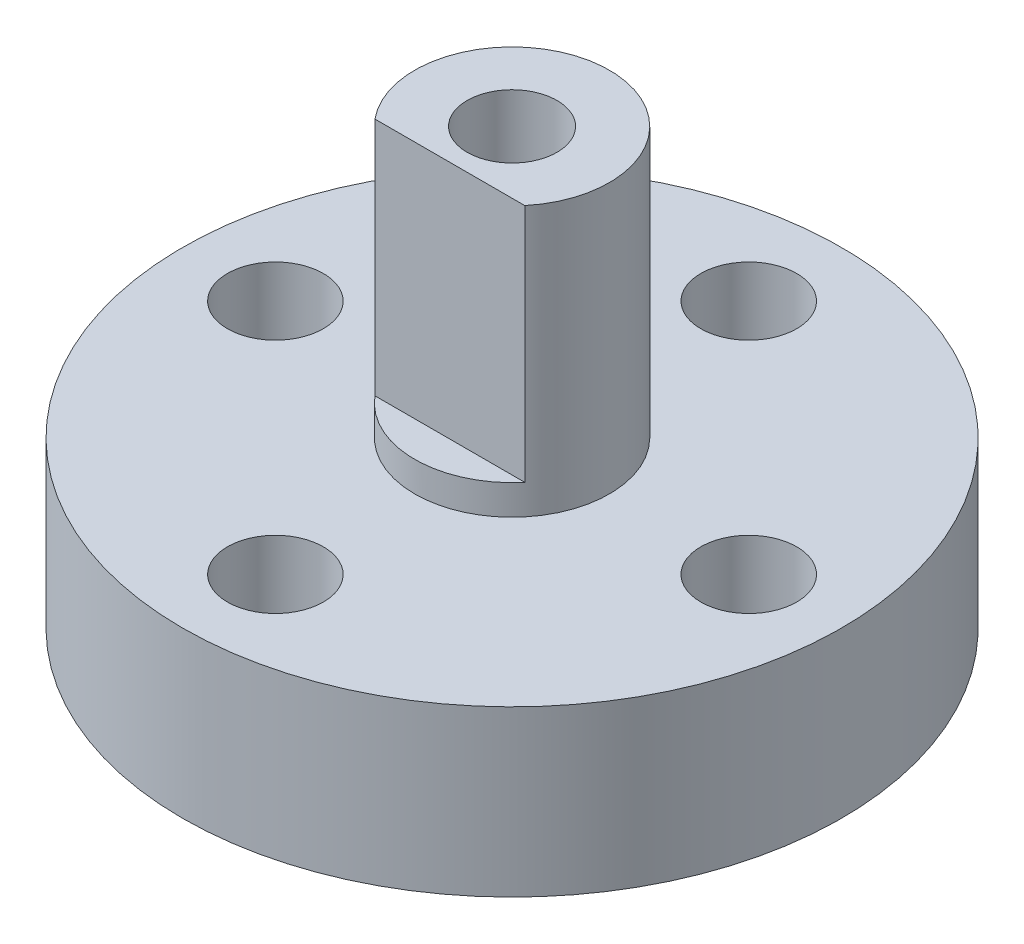
from build123d import *

# Parameters (mm, degrees)
SKETCH1_R           = 11
SKETCH1_R_2         = 1.6
BOSS_EXTRUDE1_DEPTH = 5.5
SKETCH2_R           = 3.25
BOSS_EXTRUDE3_DEPTH = 9
CUT_EXTRUDE2_START  = -8
CUT_EXTRUDE2_DEPTH  = 8
SKETCH5_R           = 1.5
CUT_EXTRUDE3_DEPTH  = 22.266170318
CHAMFER1_SIZE       = 1.25
CHAMFER1_SIZE2      = 0.721687836


with BuildPart() as part:
    # Sketch1 → Boss-Extrude1 (new body)
    with BuildSketch(Plane(origin=(0, 0, 0), x_dir=(1, 0, 0), z_dir=(0, 1, 0))):
        with Locations(Location((0, 0, 0), (0, 0, 270))):
            Circle(SKETCH1_R)
        with Locations(Location((0, 7.9, 0), (0, 0, 270))):
            Circle(SKETCH1_R_2, mode=Mode.SUBTRACT)
        with Locations(Location((7.9, 0, 0), (0, 0, 270))):
            Circle(SKETCH1_R_2, mode=Mode.SUBTRACT)
        with Locations(Location((0, -7.9, 0), (0, 0, 270))):
            Circle(SKETCH1_R_2, mode=Mode.SUBTRACT)
        with Locations(Location((-7.9, 0, 0), (0, 0, 270))):
            Circle(SKETCH1_R_2, mode=Mode.SUBTRACT)
    extrude(amount=BOSS_EXTRUDE1_DEPTH)

    # Sketch2 → Boss-Extrude3 (add)
    with BuildSketch(Plane(origin=(0, 5.5, 0), x_dir=(1, 0, 0), z_dir=(0, 1, 0))):
        with Locations(Location((0, 0, 0), (0, 0, 270))):
            Circle(SKETCH2_R)
    extrude(amount=BOSS_EXTRUDE3_DEPTH)

    # Sketch4 → Cut-Extrude2 (cut)
    with BuildSketch(Plane(origin=(0, 14.5, 0), x_dir=(1, 0, 0), z_dir=(0, 1, 0)).offset(CUT_EXTRUDE2_START)):
        with BuildLine():
            Line((2.5, -2.076655966), (-2.5, -2.076655966))
            ThreePointArc((-2.5, -2.076655966), (0, -3.25), (2.5, -2.076655966))
        make_face()
    extrude(amount=CUT_EXTRUDE2_DEPTH, mode=Mode.SUBTRACT)

    # Sketch5 → Cut-Extrude3 (cut, through all)
    with BuildSketch(Plane(origin=(0, 14.5, 0), x_dir=(1, 0, 0), z_dir=(0, 1, 0))):
        with Locations(Location((0, 0, 0), (0, 0, 270))):
            Circle(SKETCH5_R)
    extrude(amount=-CUT_EXTRUDE3_DEPTH, mode=Mode.SUBTRACT)

    # Chamfer1
    chamfer1_edges = [part.edges().sort_by_distance(p)[0] for p in [
        (0, 0, -1.5),
    ]]
    chamfer1_side = [part.faces().sort_by_distance(p)[0] for p in [
        (0, 0, -10.688873016),
    ]]
    chamfer(chamfer1_edges, length=CHAMFER1_SIZE, length2=CHAMFER1_SIZE2, reference=chamfer1_side[0])


solid = part.part
